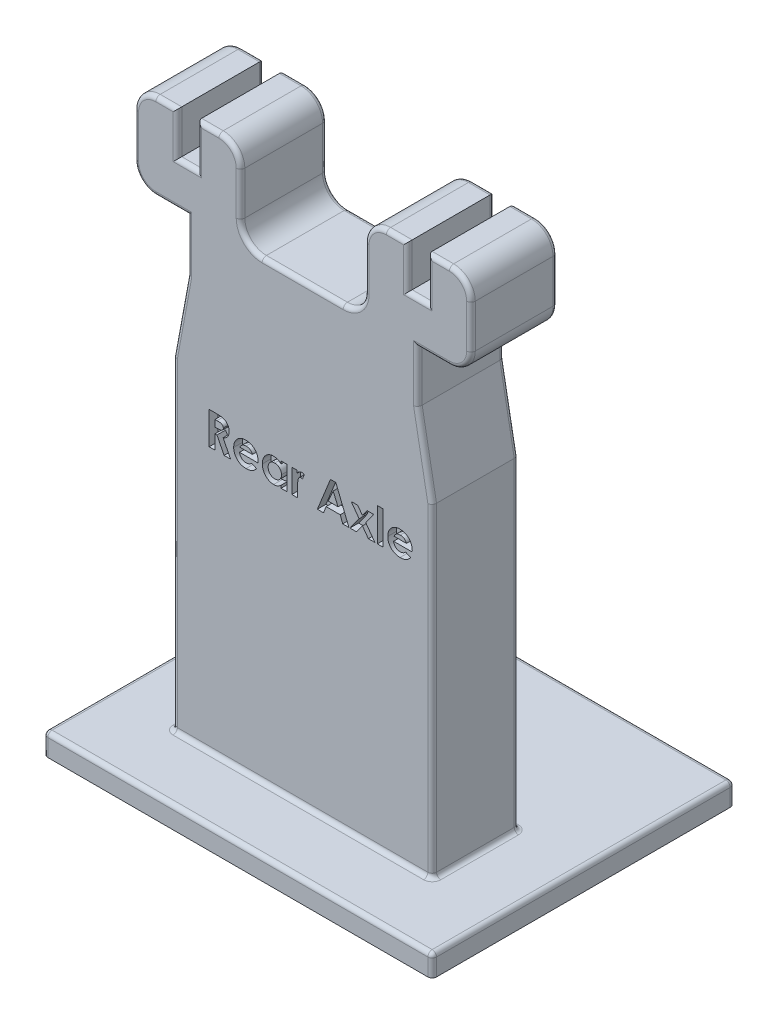
from build123d import *

# Parameters (mm, degrees)
SKETCH1_W           = 114.3
SKETCH1_H           = 88.9
BOSS_EXTRUDE1_DEPTH = 6.35
BOSS_EXTRUDE2_START = -6.35
SKETCH2_W           = 76.2
SKETCH2_H           = 25.4
BOSS_EXTRUDE2_DEPTH = 101.6
BOSS_EXTRUDE3_DEPTH = 25.4
FILLET1_R           = 6.35
FILLET2_R           = 1.27
FILLET3_R           = 1.27
SKETCH4_W           = 1.709615384
SKETCH4_H           = 9.769230769
CUT_EXTRUDE1_DEPTH  = 2.54


with BuildPart() as part:
    # Sketch1 → Boss-Extrude1 (new body)
    with BuildSketch(Plane(origin=(0, 0, 0), x_dir=(1, 0, 0), z_dir=(0, 1, 0))):
        with Locations((-57.15, 44.45)):
            Rectangle(SKETCH1_W, SKETCH1_H)
    extrude(amount=BOSS_EXTRUDE1_DEPTH)

    # Sketch2 → Boss-Extrude2 (add)
    with BuildSketch(Plane(origin=(0, 6.35, 0), x_dir=(1, 0, 0), z_dir=(0, 1, 0)).offset(BOSS_EXTRUDE2_START)):
        with Locations((-57.15, 31.75)):
            Rectangle(SKETCH2_W, SKETCH2_H)
    extrude(amount=BOSS_EXTRUDE2_DEPTH)

    # Sketch3 → Boss-Extrude3 (add)
    with BuildSketch(Plane.XY.offset(-19.05)):
        Polygon((-57.15, 124.46), (-91.0336, 124.46), (-95.25, 101.6), (-57.15, 101.6), align=None)
        Polygon((-23.2664, 124.46), (-57.15, 124.46), (-57.15, 101.6), (-19.05, 101.6), align=None)
        Polygon((-75.4126, 139.7), (-91.0336, 139.7), (-91.0336, 124.46), (-57.15, 124.46), (-57.15, 139.7), align=None)
        Polygon((-38.8874, 139.7), (-57.15, 139.7), (-57.15, 124.46), (-23.2664, 124.46), (-23.2664, 139.7), align=None)
        Polygon((-88.1126, 165.1), (-75.4126, 165.1), (-75.4126, 139.7), (-106.6546, 139.7), (-106.6546, 165.1), (-93.9546, 165.1), (-93.9546, 152.4), (-88.1126, 152.4), align=None)
        Polygon((-20.3454, 165.1), (-7.6454, 165.1), (-7.6454, 139.7), (-38.8874, 139.7), (-38.8874, 165.1), (-26.1874, 165.1), (-26.1874, 152.4), (-20.3454, 152.4), align=None)
    extrude(amount=-BOSS_EXTRUDE3_DEPTH)

    # Fillet1
    fillet1_edges = [part.edges().sort_by_distance(p)[0] for p in [
        (-7.6454, 139.7, -31.75),
        (-7.6454, 165.1, -31.75),
        (-38.8874, 165.1, -31.75),
        (-38.8874, 139.7, -31.75),
        (-75.4126, 139.7, -31.75),
        (-75.4126, 165.1, -31.75),
        (-106.6546, 165.1, -31.75),
        (-106.6546, 139.7, -31.75),
    ]]
    fillet(fillet1_edges, radius=FILLET1_R)

    # Fillet2
    fillet2_edges = [part.edges().sort_by_distance(p)[0] for p in [
        (-104.794728061, 141.559871939, -44.45),
        (-104.794728061, 163.240128061, -44.45),
        (-77.272471939, 163.240128061, -44.45),
        (-9.505271939, 163.240128061, -44.45),
        (-9.505271939, 141.559871939, -44.45),
        (-37.027528061, 163.240128061, -44.45),
        (-40.747271939, 141.559871939, -19.05),
        (-40.747271939, 141.559871939, -44.45),
        (-73.552728061, 141.559871939, -19.05),
        (-73.552728061, 141.559871939, -44.45),
        (-57.15, 6.35, -44.45),
        (-95.25, 6.35, -31.75),
        (-57.15, 6.35, -19.05),
        (-19.05, 6.35, -31.75),
        (-19.05, 53.975, -44.45),
        (-95.25, 53.975, -44.45),
        (-95.25, 53.975, -19.05),
        (-19.05, 53.975, -19.05),
        (-21.1582, 113.03, -19.05),
        (-20.3454, 158.75, -19.05),
        (-23.2664, 152.4, -19.05),
        (-26.1874, 158.75, -19.05),
        (-91.0336, 132.08, -19.05),
        (-93.1418, 113.03, -19.05),
        (-23.2664, 132.08, -44.45),
        (-23.2664, 132.08, -19.05),
        (-18.6309, 139.7, -44.45),
        (-17.1704, 165.1, -19.05),
        (-29.3624, 165.1, -44.45),
        (-84.9376, 165.1, -19.05),
        (-88.1126, 158.75, -44.45),
        (-88.1126, 158.75, -19.05),
        (-91.0336, 152.4, -44.45),
        (-91.0336, 152.4, -19.05),
        (-93.9546, 158.75, -44.45),
        (-93.9546, 158.75, -19.05),
        (-97.1296, 165.1, -44.45),
        (-21.1582, 113.03, -44.45),
        (-93.1418, 113.03, -44.45),
        (-91.0336, 132.08, -44.45),
        (-95.6691, 139.7, -44.45),
        (-26.1874, 158.75, -44.45),
        (-23.2664, 152.4, -44.45),
        (-20.3454, 158.75, -44.45),
        (-29.3624, 165.1, -19.05),
        (-18.6309, 139.7, -19.05),
        (-7.6454, 152.4, -19.05),
        (-38.8874, 152.4, -19.05),
        (-57.15, 139.7, -19.05),
        (-75.4126, 152.4, -19.05),
        (-97.1296, 165.1, -19.05),
        (-106.6546, 152.4, -19.05),
        (-95.6691, 139.7, -19.05),
        (-104.794728061, 141.559871939, -19.05),
        (-104.794728061, 163.240128061, -19.05),
        (-77.272471939, 163.240128061, -19.05),
        (-9.505271939, 163.240128061, -19.05),
        (-9.505271939, 141.559871939, -19.05),
        (-37.027528061, 163.240128061, -19.05),
        (-38.8874, 152.4, -44.45),
        (-106.6546, 152.4, -44.45),
        (-84.9376, 165.1, -44.45),
        (-75.4126, 152.4, -44.45),
        (-57.15, 139.7, -44.45),
        (-17.1704, 165.1, -44.45),
        (-7.6454, 152.4, -44.45),
    ]]
    fillet(fillet2_edges, radius=FILLET2_R)

    # Fillet3
    fillet3_edges = [part.edges().sort_by_distance(p)[0] for p in [
        (-114.3, 6.35, -44.45),
        (-57.15, 6.35, 0),
        (0, 6.35, -44.45),
        (0, 3.175, 0),
        (-114.3, 3.175, 0),
        (-114.3, 3.175, -88.9),
        (0, 3.175, -88.9),
        (-57.15, 6.35, -88.9),
    ]]
    fillet(fillet3_edges, radius=FILLET3_R)

    # Sketch4 → Cut-Extrude1 (cut)
    # profile 1 of 8: a face of its own
    with BuildSketch(Plane.XY.offset(-19.05)):
        with BuildLine():
            Line((-84.625961538, 93.345), (-82.633954327, 93.345))
            add(Edge.make_bspline(
                [(-82.633954327, 93.345), (-82.502283257, 93.344532643), (-82.249042699, 93.343633785), (-81.883883646, 93.329452176), (-81.548434838, 93.309717304), (-81.242199613, 93.279601365), (-80.965308984, 93.239671271), (-80.717485441, 93.192600298), (-80.498736228, 93.138952831), (-80.307216497, 93.072103856), (-80.134379411, 92.996699225), (-79.973271217, 92.910057921), (-79.820337631, 92.813144724), (-79.676600846, 92.703409583), (-79.540811758, 92.582826607), (-79.412714191, 92.451274418), (-79.294118283, 92.307637507), (-79.185758385, 92.152823478), (-79.086997061, 91.989962669), (-78.999712764, 91.818831472), (-78.928733028, 91.639310876), (-78.866014823, 91.453995342), (-78.820840932, 91.260235748), (-78.789423151, 91.059918376), (-78.766420282, 90.852338089), (-78.765097727, 90.711317258), (-78.764423077, 90.63938101)],
                knots=[0, 0, 0, 0, 1.749336639, 3.364467119, 4.854658419, 6.213483162, 7.451590619, 8.570285859, 9.5643256, 10.440900261, 11.26203566, 12.067320669, 12.869050712, 13.665104639, 14.467235401, 15.27997916, 16.102287765, 16.939272006, 17.78853747, 18.631303466, 19.488103222, 20.351255419, 21.228522269, 22.127379805, 23.044756219, 24, 24, 24, 24], degree=3))
            add(Edge.make_bspline(
                [(-78.764423077, 90.63938101), (-78.766175574, 90.564296092), (-78.769611901, 90.417068252), (-78.78812183, 90.200802564), (-78.821952165, 89.993894681), (-78.873193128, 89.796950403), (-78.932087961, 89.60751853), (-79.01040298, 89.429094198), (-79.09878922, 89.259082484), (-79.203762974, 89.099888267), (-79.318966542, 88.947975527), (-79.452945867, 88.809164603), (-79.597021148, 88.675994935), (-79.759291382, 88.556807818), (-79.932603545, 88.443544251), (-80.120401167, 88.340897296), (-80.321458618, 88.246286644), (-80.462811963, 88.19352521), (-80.535096154, 88.166544471)],
                knots=[0, 0, 0, 0, 1.099860209, 2.156625411, 3.176576793, 4.16617041, 5.135385252, 6.078461593, 7.016046972, 7.938469504, 8.868247731, 9.803980173, 10.76021508, 11.73834243, 12.748633912, 13.790971185, 14.870363756, 16, 16, 16, 16], degree=3))
            Line((-80.535096154, 88.166544471), (-78.337019231, 83.82))
            Line((-78.337019231, 83.82), (-80.237439904, 83.82))
            Line((-80.237439904, 83.82), (-82.336298077, 87.971923077))
            Line((-82.336298077, 87.971923077), (-82.916346154, 87.971923077))
            Line((-82.916346154, 87.971923077), (-82.916346154, 83.82))
            Line((-82.916346154, 83.82), (-84.625961538, 83.82))
            Line((-84.625961538, 83.82), (-84.625961538, 93.345))
        make_face()
        with BuildLine():
            Line((-82.916346154, 89.681538462), (-82.250435697, 89.681538462))
            add(Edge.make_bspline(
                [(-82.250435697, 89.681538462), (-82.169022608, 89.68245539), (-82.013134037, 89.684211112), (-81.788945797, 89.692354878), (-81.585329408, 89.711977329), (-81.401410475, 89.736769563), (-81.236263532, 89.765395778), (-81.091361634, 89.806418881), (-80.964472061, 89.850376175), (-80.857098462, 89.905003688), (-80.765360926, 89.967127019), (-80.686151435, 90.037700667), (-80.620633829, 90.119380679), (-80.566709497, 90.209947343), (-80.52476223, 90.310201701), (-80.494143938, 90.419043185), (-80.477032841, 90.537711641), (-80.475064151, 90.619609034), (-80.474038462, 90.662277644)],
                knots=[0, 0, 0, 0, 1.688639943, 3.233382647, 4.650958383, 5.928841754, 7.082724185, 8.122798841, 9.049171256, 9.863274652, 10.613301712, 11.341792392, 12.054588806, 12.776240173, 13.521029143, 14.301969904, 15.115324896, 16, 16, 16, 16], degree=3))
            add(Edge.make_bspline(
                [(-80.474038462, 90.662277644), (-80.475977621, 90.712757725), (-80.47978674, 90.81191649), (-80.517585035, 90.954670342), (-80.577751757, 91.086798799), (-80.660223853, 91.207704871), (-80.764086737, 91.313699481), (-80.88327759, 91.407134574), (-81.020368839, 91.481016054), (-81.147305019, 91.529747491), (-81.262787273, 91.558904013), (-81.367006363, 91.580631195), (-81.487692698, 91.596029873), (-81.624937388, 91.612362912), (-81.778390591, 91.62295406), (-81.948888721, 91.630683488), (-82.135942107, 91.633845977), (-82.266336083, 91.634856968), (-82.334390024, 91.635384615)],
                knots=[0, 0, 0, 0, 1.020303359, 2.004196876, 2.966617323, 3.9489082, 4.950758222, 5.960522915, 7.003732012, 8.091992268, 8.70421221, 9.413913587, 10.24622431, 11.166358409, 12.212345909, 13.359657661, 14.621978493, 16, 16, 16, 16], degree=3))
            Line((-82.334390024, 91.635384615), (-82.916346154, 91.635384615))
            Line((-82.916346154, 91.635384615), (-82.916346154, 89.681538462))
        make_face(mode=Mode.SUBTRACT)
    # profile 2 of 8: a face of its own
    with BuildSketch(Plane.XY.offset(-19.05)):
        with BuildLine():
            Line((-70.222070313, 86.872884615), (-75.711538462, 86.872884615))
            add(Edge.make_bspline(
                [(-75.711538462, 86.872884615), (-75.700345879, 86.80910011), (-75.678351572, 86.683758524), (-75.630590152, 86.501688994), (-75.569639417, 86.330109743), (-75.496593799, 86.16879141), (-75.412684847, 86.016881169), (-75.314812007, 85.875091538), (-75.204216705, 85.743547755), (-75.081538375, 85.622821524), (-74.948821842, 85.514648205), (-74.806710731, 85.419881539), (-74.655058394, 85.34217867), (-74.495603466, 85.276683214), (-74.327154453, 85.224804178), (-74.14946344, 85.189024194), (-73.963001459, 85.167888826), (-73.835977861, 85.164831837), (-73.771048678, 85.163269231)],
                knots=[0, 0, 0, 0, 1.091296461, 2.144483647, 3.168565212, 4.157007626, 5.126487748, 6.090021542, 7.05641414, 8.019231907, 8.98705074, 9.938580405, 10.892824166, 11.854447369, 12.841318655, 13.858982407, 14.905600794, 16, 16, 16, 16], degree=3))
            add(Edge.make_bspline(
                [(-73.771048678, 85.163269231), (-73.692674746, 85.165338378), (-73.538333392, 85.169413139), (-73.31222216, 85.205550216), (-73.093539662, 85.260133681), (-72.884355404, 85.341303876), (-72.682246316, 85.442346501), (-72.490539733, 85.568233177), (-72.305917366, 85.715285087), (-72.193275965, 85.828632643), (-72.135847356, 85.886421274)],
                knots=[0, 0, 0, 0, 1.021034703, 2.010718019, 2.977989445, 3.954245119, 4.929443971, 5.918328161, 6.938689359, 8, 8, 8, 8], degree=3))
            Line((-72.135847356, 85.886421274), (-70.704807692, 85.205246394))
            add(Edge.make_bspline(
                [(-70.704807692, 85.205246394), (-70.749863141, 85.142986679), (-70.839138855, 85.019621343), (-70.984878463, 84.846014455), (-71.136967024, 84.684032184), (-71.295517966, 84.534739915), (-71.46073237, 84.398563071), (-71.63215065, 84.27384277), (-71.812278015, 84.163927705), (-71.99751285, 84.06350025), (-72.191684302, 83.977404258), (-72.394255012, 83.903984635), (-72.604366981, 83.837613921), (-72.824673468, 83.787043073), (-73.053339983, 83.747011602), (-73.290913542, 83.718583954), (-73.537362833, 83.701025559), (-73.70487298, 83.698944032), (-73.790129207, 83.697884615)],
                knots=[0, 0, 0, 0, 1.028154879, 2.037251081, 3.030720504, 4.000128189, 4.949298328, 5.894184978, 6.834267904, 7.770992897, 8.712077017, 9.673380525, 10.653304757, 11.658697181, 12.695551717, 13.758623199, 14.859225354, 16, 16, 16, 16], degree=3))
            add(Edge.make_bspline(
                [(-73.790129207, 83.697884615), (-73.921294512, 83.700558681), (-74.178174202, 83.705795686), (-74.553907185, 83.754402578), (-74.910749306, 83.834998045), (-75.249708162, 83.944555204), (-75.569318547, 84.089204976), (-75.869738637, 84.266123647), (-76.153970058, 84.471919331), (-76.413327955, 84.710911132), (-76.64961065, 84.971039499), (-76.857146679, 85.250399602), (-77.030809872, 85.547039657), (-77.173425579, 85.858996439), (-77.284271461, 86.187068434), (-77.364184912, 86.531398807), (-77.413172815, 86.891823098), (-77.418463752, 87.137312275), (-77.421153846, 87.262127404)],
                knots=[0, 0, 0, 0, 1.103565453, 2.161269334, 3.182010356, 4.179077853, 5.15417608, 6.128274628, 7.109042802, 8.101804412, 9.090965879, 10.063106201, 11.02526161, 11.978650795, 12.945248442, 13.93468508, 14.949922959, 16, 16, 16, 16], degree=3))
            add(Edge.make_bspline(
                [(-77.421153846, 87.262127404), (-77.418437276, 87.390114245), (-77.413092546, 87.641922608), (-77.364606698, 88.010669261), (-77.284050528, 88.362503444), (-77.172880397, 88.697909669), (-77.032428188, 89.017936942), (-76.856555429, 89.319785409), (-76.649713639, 89.604505941), (-76.414282147, 89.870766588), (-76.153825531, 90.111095911), (-75.877065769, 90.325277366), (-75.580893181, 90.503747571), (-75.268657735, 90.647951386), (-74.942356601, 90.765113346), (-74.598218194, 90.843074845), (-74.238860883, 90.895421325), (-73.993212139, 90.900242109), (-73.868359375, 90.902692308)],
                knots=[0, 0, 0, 0, 1.079208495, 2.12329425, 3.130605359, 4.119693003, 5.099659317, 6.073216462, 7.060498243, 8.06384408, 9.066070512, 10.045757761, 11.010926815, 11.975797609, 12.942977511, 13.929384301, 14.947594487, 16, 16, 16, 16], degree=3))
            add(Edge.make_bspline(
                [(-73.868359375, 90.902692308), (-73.736565699, 90.899976756), (-73.477802399, 90.894645049), (-73.099452551, 90.846432833), (-72.740241042, 90.765345904), (-72.398637429, 90.656736066), (-72.07900413, 90.508432288), (-71.774317833, 90.335867306), (-71.491886642, 90.125623192), (-71.228700143, 89.88780094), (-70.99112054, 89.623945394), (-70.783449642, 89.337317457), (-70.606747268, 89.03071445), (-70.463528239, 88.702893033), (-70.352796176, 88.354837358), (-70.27280875, 87.986999443), (-70.224194508, 87.597980209), (-70.219002024, 87.331596444), (-70.216346154, 87.195345553)],
                knots=[0, 0, 0, 0, 1.080001299, 2.120471247, 3.119684163, 4.095710327, 5.052285597, 6.002875087, 6.961153713, 7.931888285, 8.906493152, 9.865905668, 10.82813294, 11.801621613, 12.7925306, 13.817193356, 14.883530496, 16, 16, 16, 16], degree=3))
            Line((-70.216346154, 87.195345553), (-70.222070313, 86.872884615))
        make_face()
        with BuildLine():
            add(Edge.make_bspline(
                [(-71.925961538, 88.216153846), (-71.958223026, 88.303214534), (-72.022367269, 88.47631386), (-72.167266442, 88.715148693), (-72.359543009, 88.921989358), (-72.58317445, 89.10510704), (-72.838687375, 89.253736788), (-73.118030123, 89.361349553), (-73.417671856, 89.425875517), (-73.623809222, 89.433443279), (-73.729071514, 89.437307692)],
                knots=[0, 0, 0, 0, 0.954238005, 1.897273737, 2.851915805, 3.847685534, 4.862635127, 5.880135777, 6.917509367, 8, 8, 8, 8], degree=3))
            add(Edge.make_bspline(
                [(-73.729071514, 89.437307692), (-73.844035076, 89.433595453), (-74.068764901, 89.426338798), (-74.392922373, 89.349161606), (-74.698692004, 89.233976953), (-74.878956449, 89.11521913), (-74.969305889, 89.055697115)],
                knots=[0, 0, 0, 0, 1.044195649, 2.041185066, 3.018232172, 4, 4, 4, 4], degree=3))
            add(Edge.make_bspline(
                [(-74.969305889, 89.055697115), (-75.025677192, 89.010363846), (-75.145857928, 88.913715632), (-75.301936996, 88.720911622), (-75.455676176, 88.487469247), (-75.543085377, 88.310153271), (-75.589423077, 88.216153846)],
                knots=[0, 0, 0, 0, 0.82159062, 1.751589201, 2.808063854, 4, 4, 4, 4], degree=3))
            Line((-75.589423077, 88.216153846), (-71.925961538, 88.216153846))
        make_face(mode=Mode.SUBTRACT)
    # profile 3 of 8: a face of its own
    with BuildSketch(Plane.XY.offset(-19.05)):
        with BuildLine():
            Line((-63.5, 90.780576923), (-61.790384615, 90.780576923))
            Line((-61.790384615, 90.780576923), (-61.790384615, 83.82))
            Line((-61.790384615, 83.82), (-63.5, 83.82))
            Line((-63.5, 83.82), (-63.5, 84.579405048))
            add(Edge.make_bspline(
                [(-63.5, 84.579405048), (-63.584710812, 84.505485372), (-63.749117771, 84.362021877), (-64.008169938, 84.175874345), (-64.267979085, 84.022326689), (-64.529793603, 83.900034355), (-64.797637471, 83.809734053), (-65.073439057, 83.744354526), (-65.361170197, 83.705798619), (-65.556765863, 83.700550095), (-65.65609976, 83.697884615)],
                knots=[0, 0, 0, 0, 1.129196829, 2.191548051, 3.199897424, 4.157751732, 5.089409408, 6.034969131, 7.002052659, 8, 8, 8, 8], degree=3))
            add(Edge.make_bspline(
                [(-65.65609976, 83.697884615), (-65.767606475, 83.700393168), (-65.987950064, 83.705350209), (-66.311279818, 83.75753107), (-66.623486841, 83.837405507), (-66.924317706, 83.95043782), (-67.213225079, 84.096905538), (-67.492419978, 84.272987113), (-67.757116151, 84.484864063), (-68.009517104, 84.723369012), (-68.240613903, 84.985726152), (-68.442640905, 85.268294003), (-68.612934654, 85.567064964), (-68.75244721, 85.88104847), (-68.862191852, 86.210014077), (-68.940424077, 86.555005163), (-68.98658118, 86.916144942), (-68.992294129, 87.162139215), (-68.995192308, 87.286932091)],
                knots=[0, 0, 0, 0, 0.980476535, 1.937477201, 2.874147792, 3.812856188, 4.758993464, 5.720109578, 6.712210464, 7.737600662, 8.772720504, 9.783789959, 10.789002326, 11.793715968, 12.802552247, 13.835794126, 14.902098527, 16, 16, 16, 16], degree=3))
            add(Edge.make_bspline(
                [(-68.995192308, 87.286932091), (-68.992150659, 87.416155279), (-68.986184125, 87.669640959), (-68.942539287, 88.041619143), (-68.86575074, 88.395164254), (-68.761044037, 88.730766004), (-68.626357045, 89.048482373), (-68.462317288, 89.348833881), (-68.266693158, 89.631035458), (-68.041271028, 89.890283833), (-67.797870494, 90.127897492), (-67.537474952, 90.334759025), (-67.264156419, 90.510497523), (-66.977624446, 90.653968335), (-66.677919951, 90.764835318), (-66.366226163, 90.845888136), (-66.041159382, 90.894522673), (-65.819721255, 90.89994648), (-65.707617188, 90.902692308)],
                knots=[0, 0, 0, 0, 1.136281865, 2.228943489, 3.287578264, 4.313574083, 5.316051562, 6.317280042, 7.318008486, 8.329309503, 9.333984563, 10.305318864, 11.248632312, 12.186624717, 13.117503092, 14.05354244, 15.014596925, 16, 16, 16, 16], degree=3))
            add(Edge.make_bspline(
                [(-65.707617188, 90.902692308), (-65.603772497, 90.900534913), (-65.398301284, 90.896266205), (-65.096288207, 90.849916212), (-64.803379081, 90.779815138), (-64.521171741, 90.679933726), (-64.247351428, 90.553813123), (-63.986628024, 90.395774608), (-63.733297969, 90.212460467), (-63.578726805, 90.06928824), (-63.5, 89.996367188)],
                knots=[0, 0, 0, 0, 1.017011718, 2.012299608, 2.98747302, 3.965332399, 4.941441765, 5.936729654, 6.94912688, 8, 8, 8, 8], degree=3))
            Line((-63.5, 89.996367188), (-63.5, 90.780576923))
        make_face()
        with BuildLine():
            add(Edge.make_bspline(
                [(-65.348903245, 89.315192308), (-65.417026379, 89.313102055), (-65.550543272, 89.309005296), (-65.746898136, 89.284363003), (-65.934554482, 89.240942187), (-66.112173959, 89.176797254), (-66.282403751, 89.09865938), (-66.442658892, 89.000792979), (-66.594262015, 88.885116972), (-66.736321526, 88.754431875), (-66.865829702, 88.610785059), (-66.977473309, 88.45403526), (-67.072352337, 88.288405994), (-67.152595337, 88.113399271), (-67.210031119, 87.92694422), (-67.255520234, 87.731468155), (-67.279126141, 87.525374135), (-67.283405147, 87.38492744), (-67.285576923, 87.313644832)],
                knots=[0, 0, 0, 0, 1.04836806, 2.054732945, 3.03993516, 4.00574415, 4.955904794, 5.917688631, 6.888591924, 7.88601754, 8.884115178, 9.859153345, 10.841239365, 11.818093293, 12.814750328, 13.83810466, 14.90274714, 16, 16, 16, 16], degree=3))
            add(Edge.make_bspline(
                [(-67.285576923, 87.313644832), (-67.283438322, 87.241715649), (-67.279224232, 87.099980029), (-67.25513855, 86.892147533), (-67.211286321, 86.693816021), (-67.147307571, 86.50658887), (-67.069174678, 86.327939765), (-66.974069376, 86.158693189), (-66.85724917, 86.001841633), (-66.727627466, 85.853673463), (-66.582653626, 85.721365037), (-66.430192671, 85.603887302), (-66.268162106, 85.505593757), (-66.098319847, 85.426152291), (-65.921237591, 85.361414175), (-65.734695264, 85.318539069), (-65.540520283, 85.291129825), (-65.408146071, 85.287312909), (-65.341271034, 85.285384615)],
                knots=[0, 0, 0, 0, 1.099136573, 2.165835871, 3.191374663, 4.196217796, 5.183857741, 6.167377911, 7.154730987, 8.166690795, 9.170734848, 10.148332609, 11.103258353, 12.059567475, 13.009337315, 13.978056681, 14.978520572, 16, 16, 16, 16], degree=3))
            add(Edge.make_bspline(
                [(-65.341271034, 85.285384615), (-65.271879027, 85.287486587), (-65.135832972, 85.291607593), (-64.936274678, 85.316024998), (-64.746097434, 85.359605021), (-64.56609248, 85.424117198), (-64.393510412, 85.501694197), (-64.229908628, 85.597648214), (-64.077062453, 85.713058775), (-63.934197791, 85.84492527), (-63.80328987, 85.989745048), (-63.690102321, 86.148550372), (-63.591511825, 86.316262211), (-63.513974935, 86.496845884), (-63.452399772, 86.687142021), (-63.408221012, 86.888331639), (-63.384190329, 87.100631646), (-63.380013095, 87.245534673), (-63.377884615, 87.31936899)],
                knots=[0, 0, 0, 0, 1.050008698, 2.058587853, 3.036635738, 3.995319155, 4.947022481, 5.895997462, 6.858296291, 7.838991643, 8.833936038, 9.806048392, 10.784806122, 11.771666913, 12.772873988, 13.80724452, 14.882696879, 16, 16, 16, 16], degree=3))
            add(Edge.make_bspline(
                [(-63.377884615, 87.31936899), (-63.379986647, 87.391933393), (-63.384092525, 87.533672749), (-63.40832465, 87.741540032), (-63.452817054, 87.938779205), (-63.513124899, 88.125752819), (-63.592041193, 88.302033362), (-63.690706286, 88.465666303), (-63.802652232, 88.622320909), (-63.935009494, 88.763228303), (-64.077100225, 88.894139983), (-64.23219425, 89.006060445), (-64.395405267, 89.102516606), (-64.567736047, 89.181710833), (-64.750782294, 89.239763204), (-64.941284538, 89.28471103), (-65.142215008, 89.308990506), (-65.27888286, 89.313091305), (-65.348903245, 89.315192308)],
                knots=[0, 0, 0, 0, 1.106611376, 2.161533483, 3.185006901, 4.184773755, 5.152708835, 6.122342771, 7.094156588, 8.082475533, 9.064254463, 10.03606828, 10.992420271, 11.951521816, 12.920622147, 13.915721683, 14.932141191, 16, 16, 16, 16], degree=3))
        make_face(mode=Mode.SUBTRACT)
    # profile 4 of 8: a face of its own
    with BuildSketch(Plane.XY.offset(-19.05)):
        with BuildLine():
            Line((-60.325, 90.780576923), (-58.859615385, 90.780576923))
            Line((-58.859615385, 90.780576923), (-58.859615385, 89.923861178))
            add(Edge.make_bspline(
                [(-58.859615385, 89.923861178), (-58.818162467, 89.999997742), (-58.73714102, 90.148809815), (-58.588297826, 90.348560553), (-58.417300737, 90.516785052), (-58.230294206, 90.657001879), (-58.026711453, 90.766287128), (-57.812004062, 90.844166645), (-57.588008851, 90.89477754), (-57.435206911, 90.900035055), (-57.357977764, 90.902692308)],
                knots=[0, 0, 0, 0, 1.09866127, 2.147379032, 3.14564304, 4.131443017, 5.102343063, 6.064490016, 7.021754664, 8, 8, 8, 8], degree=3))
            add(Edge.make_bspline(
                [(-57.357977764, 90.902692308), (-57.301899767, 90.900066387), (-57.187704941, 90.894719074), (-57.013655955, 90.863635064), (-56.837095749, 90.807429262), (-56.720903919, 90.756823408), (-56.661538462, 90.730967548)],
                knots=[0, 0, 0, 0, 0.931404136, 1.896671404, 2.925354185, 4, 4, 4, 4], degree=3))
            Line((-56.661538462, 90.730967548), (-57.191977163, 89.282755409))
            add(Edge.make_bspline(
                [(-57.191977163, 89.282755409), (-57.239390809, 89.30566339), (-57.32851021, 89.348721575), (-57.457896106, 89.39953467), (-57.575319172, 89.430538338), (-57.64976324, 89.435164356), (-57.684254808, 89.437307692)],
                knots=[0, 0, 0, 0, 1.214386998, 2.282580073, 3.20428172, 4, 4, 4, 4], degree=3))
            add(Edge.make_bspline(
                [(-57.684254808, 89.437307692), (-57.716821555, 89.435887405), (-57.780885959, 89.433093454), (-57.875443226, 89.409150248), (-57.964496481, 89.367860931), (-58.052337196, 89.314965219), (-58.132035712, 89.241436222), (-58.211685, 89.156313353), (-58.281876218, 89.051217849), (-58.355948308, 88.934241216), (-58.419018045, 88.791061922), (-58.473098402, 88.620135351), (-58.521284434, 88.419483765), (-58.554443003, 88.188041802), (-58.586492091, 87.928049062), (-58.605568496, 87.637597232), (-58.619786381, 87.317604747), (-58.62065571, 87.094238444), (-58.621108774, 86.977827524)],
                knots=[0, 0, 0, 0, 0.544232178, 1.070598461, 1.618251235, 2.182094276, 2.777567932, 3.425210017, 4.127676488, 4.886675562, 5.738955394, 6.734782583, 7.883056018, 9.186093582, 10.642914445, 12.264202625, 14.053029461, 16, 16, 16, 16], degree=3))
            Line((-58.621108774, 86.977827524), (-58.615384615, 86.638194111))
            Line((-58.615384615, 86.638194111), (-58.615384615, 83.82))
            Line((-58.615384615, 83.82), (-60.325, 83.82))
            Line((-60.325, 83.82), (-60.325, 90.780576923))
        make_face()
    # profile 5 of 8: a face of its own
    with BuildSketch(Plane.XY.offset(-19.05)):
        Polygon((-48.966361178, 93.345), (-47.380769231, 93.345), (-43.534134615, 83.82), (-45.360141226, 83.82), (-46.100465745, 85.773846154), (-50.250480769, 85.773846154), (-50.990805288, 83.82), (-52.814903846, 83.82), align=None)
        Polygon((-48.174519231, 90.790117188), (-49.601742788, 87.483461538), (-46.747295673, 87.483461538), align=None, mode=Mode.SUBTRACT)
    # profile 6 of 8: a face of its own
    with BuildSketch(Plane.XY.offset(-19.05)):
        Polygon((-42.879672476, 90.780576923), (-40.95063101, 90.780576923), (-39.57492488, 88.883972356), (-38.204942909, 90.780576923), (-36.275901442, 90.780576923), (-38.607542067, 87.550243389), (-35.901923077, 83.82), (-37.830964543, 83.82), (-39.569200721, 86.216514423), (-41.299804688, 83.82), (-43.228846154, 83.82), (-40.536583534, 87.550243389), align=None)
    # profile 7 of 8: a face of its own
    with BuildSketch(Plane.XY.offset(-19.05)):
        with Locations((-34.314423077, 88.704615385)):
            Rectangle(SKETCH4_W, SKETCH4_H)
    # profile 8 of 8: a face of its own
    with BuildSketch(Plane.XY.offset(-19.05)):
        with BuildLine():
            Line((-24.91726262, 86.872884615), (-30.406730769, 86.872884615))
            add(Edge.make_bspline(
                [(-30.406730769, 86.872884615), (-30.395538187, 86.80910011), (-30.37354388, 86.683758524), (-30.32578246, 86.501688994), (-30.264831724, 86.330109743), (-30.191786107, 86.16879141), (-30.107877155, 86.016881169), (-30.010004314, 85.875091538), (-29.899409013, 85.743547755), (-29.776730683, 85.622821524), (-29.64401415, 85.514648205), (-29.501903039, 85.419881539), (-29.350250701, 85.34217867), (-29.190795774, 85.276683214), (-29.02234676, 85.224804178), (-28.844655748, 85.189024194), (-28.658193767, 85.167888826), (-28.531170169, 85.164831837), (-28.466240986, 85.163269231)],
                knots=[0, 0, 0, 0, 1.091296461, 2.144483647, 3.168565212, 4.157007626, 5.126487748, 6.090021542, 7.05641414, 8.019231907, 8.98705074, 9.938580405, 10.892824166, 11.854447369, 12.841318655, 13.858982407, 14.905600794, 16, 16, 16, 16], degree=3))
            add(Edge.make_bspline(
                [(-28.466240986, 85.163269231), (-28.387867053, 85.165338378), (-28.2335257, 85.169413139), (-28.007414468, 85.205550216), (-27.78873197, 85.260133681), (-27.579547712, 85.341303876), (-27.377438624, 85.442346501), (-27.185732041, 85.568233177), (-27.001109673, 85.715285087), (-26.888468272, 85.828632643), (-26.831039663, 85.886421274)],
                knots=[0, 0, 0, 0, 1.021034703, 2.010718019, 2.977989445, 3.954245119, 4.929443971, 5.918328161, 6.938689359, 8, 8, 8, 8], degree=3))
            Line((-26.831039663, 85.886421274), (-25.4, 85.205246394))
            add(Edge.make_bspline(
                [(-25.4, 85.205246394), (-25.445055449, 85.142986679), (-25.534331163, 85.019621343), (-25.680070771, 84.846014455), (-25.832159332, 84.684032184), (-25.990710273, 84.534739915), (-26.155924678, 84.398563071), (-26.327342958, 84.27384277), (-26.507470323, 84.163927705), (-26.692705157, 84.06350025), (-26.886876609, 83.977404258), (-27.08944732, 83.903984635), (-27.299559289, 83.837613921), (-27.519865776, 83.787043073), (-27.748532291, 83.747011602), (-27.98610585, 83.718583954), (-28.232555141, 83.701025559), (-28.400065288, 83.698944032), (-28.485321514, 83.697884615)],
                knots=[0, 0, 0, 0, 1.028154879, 2.037251081, 3.030720504, 4.000128189, 4.949298328, 5.894184978, 6.834267904, 7.770992897, 8.712077017, 9.673380525, 10.653304757, 11.658697181, 12.695551717, 13.758623199, 14.859225354, 16, 16, 16, 16], degree=3))
            add(Edge.make_bspline(
                [(-28.485321514, 83.697884615), (-28.616486819, 83.700558681), (-28.873366509, 83.705795686), (-29.249099493, 83.754402578), (-29.605941613, 83.834998045), (-29.94490047, 83.944555204), (-30.264510854, 84.089204976), (-30.564930944, 84.266123647), (-30.849162366, 84.471919331), (-31.108520262, 84.710911132), (-31.344802958, 84.971039499), (-31.552338986, 85.250399602), (-31.72600218, 85.547039657), (-31.868617887, 85.858996439), (-31.979463769, 86.187068434), (-32.05937722, 86.531398807), (-32.108365123, 86.891823098), (-32.11365606, 87.137312275), (-32.116346154, 87.262127404)],
                knots=[0, 0, 0, 0, 1.103565453, 2.161269334, 3.182010356, 4.179077853, 5.15417608, 6.128274628, 7.109042802, 8.101804412, 9.090965879, 10.063106201, 11.02526161, 11.978650795, 12.945248442, 13.93468508, 14.949922959, 16, 16, 16, 16], degree=3))
            add(Edge.make_bspline(
                [(-32.116346154, 87.262127404), (-32.113629584, 87.390114245), (-32.108284854, 87.641922608), (-32.059799006, 88.010669261), (-31.979242835, 88.362503444), (-31.868072705, 88.697909669), (-31.727620496, 89.017936942), (-31.551747736, 89.319785409), (-31.344905947, 89.604505941), (-31.109474455, 89.870766588), (-30.849017839, 90.111095911), (-30.572258076, 90.325277366), (-30.276085489, 90.503747571), (-29.963850043, 90.647951386), (-29.637548909, 90.765113346), (-29.293410502, 90.843074845), (-28.934053191, 90.895421325), (-28.688404447, 90.900242109), (-28.563551683, 90.902692308)],
                knots=[0, 0, 0, 0, 1.079208495, 2.12329425, 3.130605359, 4.119693003, 5.099659317, 6.073216462, 7.060498243, 8.06384408, 9.066070512, 10.045757761, 11.010926815, 11.975797609, 12.942977511, 13.929384301, 14.947594487, 16, 16, 16, 16], degree=3))
            add(Edge.make_bspline(
                [(-28.563551683, 90.902692308), (-28.431758007, 90.899976756), (-28.172994707, 90.894645049), (-27.794644859, 90.846432833), (-27.43543335, 90.765345904), (-27.093829736, 90.656736066), (-26.774196438, 90.508432288), (-26.46951014, 90.335867306), (-26.18707895, 90.125623192), (-25.923892451, 89.88780094), (-25.686312847, 89.623945394), (-25.47864195, 89.337317457), (-25.301939575, 89.03071445), (-25.158720547, 88.702893033), (-25.047988484, 88.354837358), (-24.968001058, 87.986999443), (-24.919386816, 87.597980209), (-24.914194331, 87.331596444), (-24.911538462, 87.195345553)],
                knots=[0, 0, 0, 0, 1.080001299, 2.120471247, 3.119684163, 4.095710327, 5.052285597, 6.002875087, 6.961153713, 7.931888285, 8.906493152, 9.865905668, 10.82813294, 11.801621613, 12.7925306, 13.817193356, 14.883530496, 16, 16, 16, 16], degree=3))
            Line((-24.911538462, 87.195345553), (-24.91726262, 86.872884615))
        make_face()
        with BuildLine():
            add(Edge.make_bspline(
                [(-26.621153846, 88.216153846), (-26.653415334, 88.303214534), (-26.717559576, 88.47631386), (-26.86245875, 88.715148693), (-27.054735317, 88.921989358), (-27.278366758, 89.10510704), (-27.533879683, 89.253736788), (-27.813222431, 89.361349553), (-28.112864164, 89.425875517), (-28.31900153, 89.433443279), (-28.424263822, 89.437307692)],
                knots=[0, 0, 0, 0, 0.954238005, 1.897273737, 2.851915805, 3.847685534, 4.862635127, 5.880135777, 6.917509367, 8, 8, 8, 8], degree=3))
            add(Edge.make_bspline(
                [(-28.424263822, 89.437307692), (-28.539227384, 89.433595453), (-28.763957208, 89.426338798), (-29.08811468, 89.349161606), (-29.393884312, 89.233976953), (-29.574148757, 89.11521913), (-29.664498197, 89.055697115)],
                knots=[0, 0, 0, 0, 1.044195649, 2.041185066, 3.018232172, 4, 4, 4, 4], degree=3))
            add(Edge.make_bspline(
                [(-29.664498197, 89.055697115), (-29.7208695, 89.010363846), (-29.841050236, 88.913715632), (-29.997129303, 88.720911622), (-30.150868484, 88.487469247), (-30.238277684, 88.310153271), (-30.284615385, 88.216153846)],
                knots=[0, 0, 0, 0, 0.82159062, 1.751589201, 2.808063854, 4, 4, 4, 4], degree=3))
            Line((-30.284615385, 88.216153846), (-26.621153846, 88.216153846))
        make_face(mode=Mode.SUBTRACT)
    extrude(amount=-CUT_EXTRUDE1_DEPTH, mode=Mode.SUBTRACT)


solid = part.part
